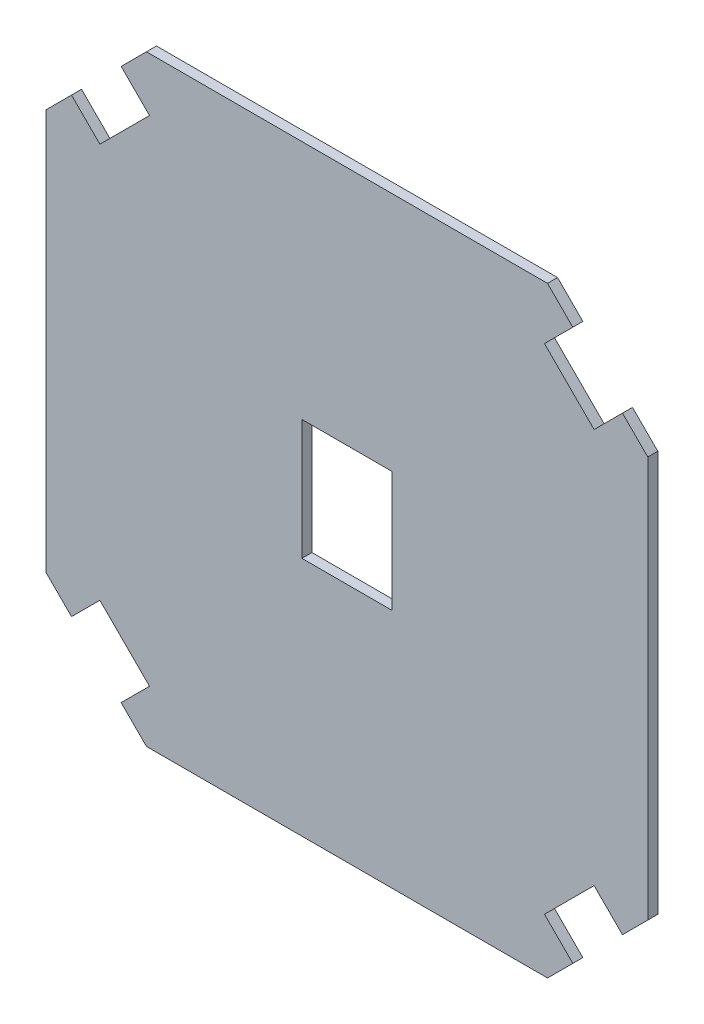
from build123d import *

# Parameters (mm, degrees)
ESQUISSE1_W        = 45
ESQUISSE1_H        = 60
BOSS_EXTRU_1_DEPTH = 5


with BuildPart() as part:
    # Esquisse1 → Boss.-Extru.1 (new body)
    with BuildSketch(Plane.XY):
        Polygon((112.625631329, 137.374368671), (100, 150), (-100, 150), (-112.625631329, 137.374368671), (-98.483495706, 123.232233047), (-123.232233047, 98.483495706), (-137.374368671, 112.625631329), (-150, 100), (-150, -100), (-137.374368671, -112.625631329), (-123.232233047, -98.483495706), (-98.483495706, -123.232233047), (-112.625631329, -137.374368671), (-100, -150), (100, -150), (112.625631329, -137.374368671), (98.483495706, -123.232233047), (123.232233047, -98.483495706), (137.374368671, -112.625631329), (150, -100), (150, 100), (137.374368671, 112.625631329), (123.232233047, 98.483495706), (98.483495706, 123.232233047), align=None)
        Rectangle(ESQUISSE1_W, ESQUISSE1_H, mode=Mode.SUBTRACT)
    extrude(amount=BOSS_EXTRU_1_DEPTH)


solid = part.part
